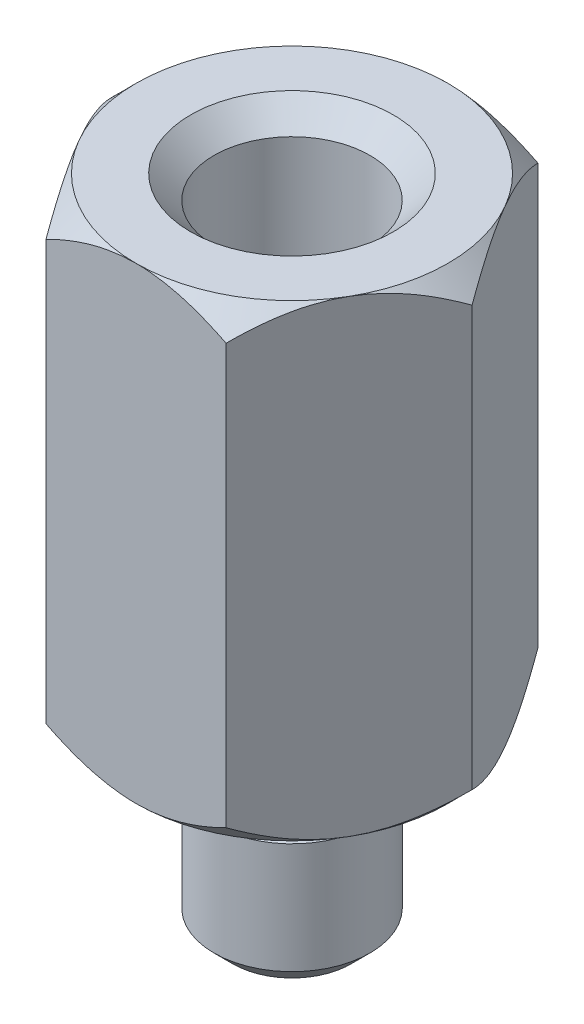
from build123d import *

# Parameters (mm, degrees)
EXTRUDE1_DEPTH = 6


with BuildPart() as part:
    # Sketch1 → Extrude1 (new body)
    with BuildSketch(Plane(origin=(0, 0, 0), x_dir=(1, 0, 0), z_dir=(0, 1, 0))):
        Polygon((1.154700538, 2), (-1.154700538, 2), (-2.309401077, 0), (-1.154700538, -2), (1.154700538, -2), (2.309401077, 0), align=None)
    extrude(amount=EXTRUDE1_DEPTH)

    # Sketch2 → Revolve1 (revolve)
    with BuildSketch(Plane(origin=(0, 0, 0), x_dir=(0, 0, -1), z_dir=(1, 0, 0)), mode=Mode.PRIVATE) as revolve1_sk:
        Polygon((0.76, 0), (0.76, -0.5), (1, -0.74), (1, -2.16), (0.76, -2.4), (0, -2.4), (0, 0), align=None)
    revolve(revolve1_sk.sketch.rotate(Axis((0, 0, 0), (0, -1, 0)), 180), axis=Axis((0, 0, 0), (0, -1, 0)))

    # Sketch3 → Cut-Revolve1 (revolve, cut)
    with BuildSketch(Plane(origin=(0, 0, 0), x_dir=(0, 0, -1), z_dir=(1, 0, 0)), mode=Mode.PRIVATE) as cut_revolve1_sk:
        Polygon((1.3, 6), (1, 5.7), (1, 2.4), (0, 1.799139381), (0, 6), align=None)
    revolve(cut_revolve1_sk.sketch.rotate(Axis((0, 6, 0), (0, -1, 0)), 180), axis=Axis((0, 6, 0), (0, -1, 0)), mode=Mode.SUBTRACT)

    # Sketch4 → Cut-Revolve3 (revolve, cut)
    with BuildSketch(Plane(origin=(0, 0, 0), x_dir=(0, 0, -1), z_dir=(1, 0, 0))):
        Polygon((2, 6), (4.5, 6), (4.5, 3.5), align=None)
        Polygon((2, 0), (4.5, 0), (4.5, 2.5), align=None)
    revolve(axis=Axis((0, 0, 0), (0, 1, 0)), mode=Mode.SUBTRACT)


solid = part.part
